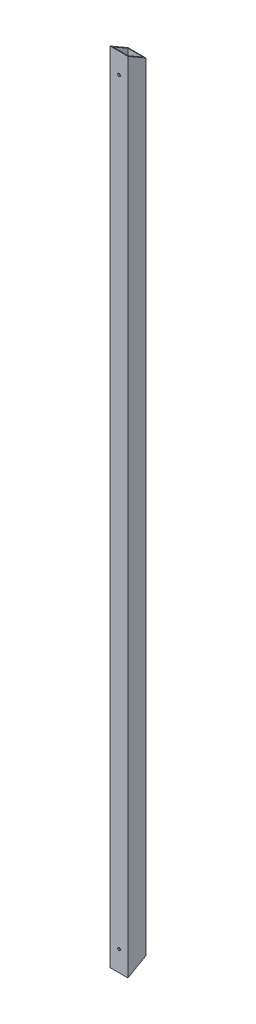
from build123d import *

# Parameters (mm, degrees)
SKETCH1_W           = 44.45
SKETCH1_H           = 1980.184
BOSS_EXTRUDE1_DEPTH = 44.45
SKETCH2_W           = 38.1
SKETCH2_H           = 38.1
CUT_EXTRUDE1_DEPTH  = 1981.807518913
CUT_EXTRUDE2_DEPTH  = 993.085567612
SKETCH13_R          = 3.3734375
CUT_EXTRUDE7_DEPTH  = 992.338449567


with BuildPart() as part:
    # Sketch1 → Boss-Extrude1 (new body)
    with BuildSketch(Plane.XY):
        Rectangle(SKETCH1_W, SKETCH1_H)
    extrude(amount=BOSS_EXTRUDE1_DEPTH)

    # Sketch2 → Cut-Extrude1 (cut, through all)
    with BuildSketch(Plane(origin=(0, 990.092, 0), x_dir=(1, 0, 0), z_dir=(0, 1, 0))):
        with Locations((0, -22.225)):
            Rectangle(SKETCH2_W, SKETCH2_H)
    extrude(amount=-CUT_EXTRUDE1_DEPTH, mode=Mode.SUBTRACT)

    # Sketch3 → Cut-Extrude2 (cut, through all)
    with BuildSketch(Plane(origin=(22.225, 0, 0), x_dir=(0, 0, -1), z_dir=(1, 0, 0))):
        Polygon((-44.45, 990.092), (0, 964.428780535), (0, 990.092), align=None)
        Polygon((-44.45, -990.092), (0, -964.428780535), (0, -990.092), align=None)
    extrude(amount=-CUT_EXTRUDE2_DEPTH, mode=Mode.SUBTRACT)

    # Sketch13 → Cut-Extrude7 (cut, through all)
    with BuildSketch(Plane.XY.offset(44.45)):
        with Locations((0, 939.038)):
            Circle(SKETCH13_R)
        with Locations((0, -939.038)):
            Circle(SKETCH13_R)
    extrude(amount=-CUT_EXTRUDE7_DEPTH, mode=Mode.SUBTRACT)


solid = part.part
